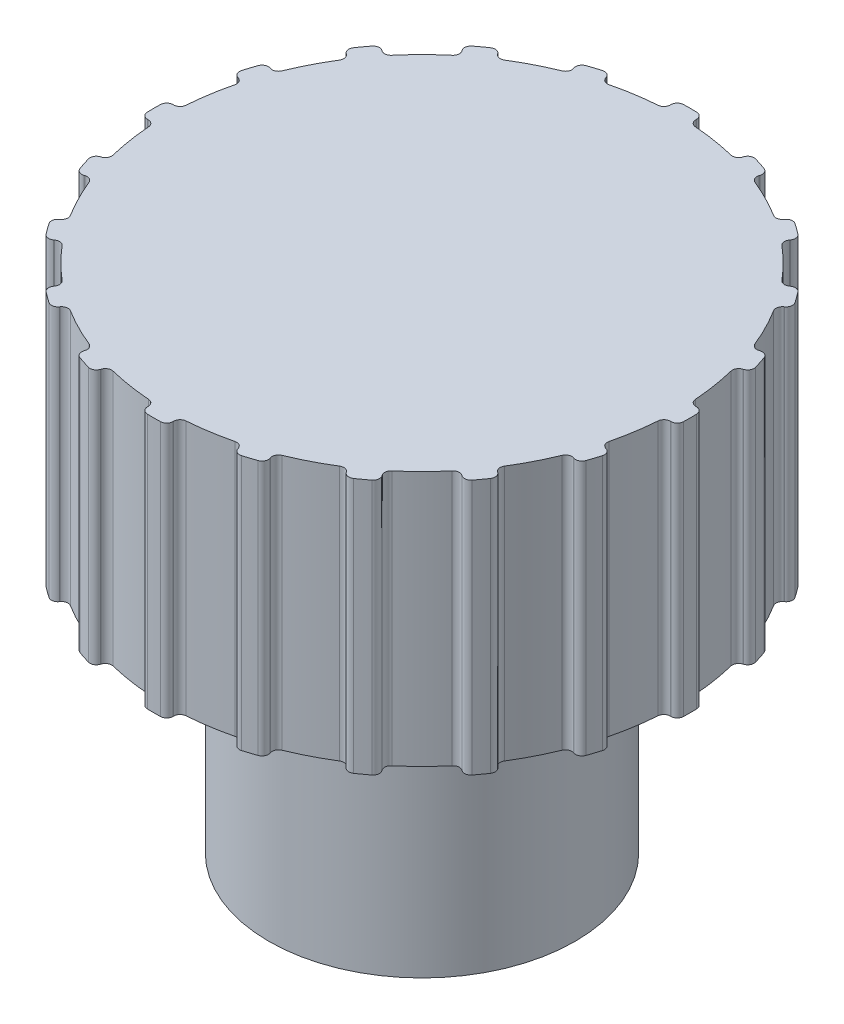
from build123d import *

# Parameters (mm, degrees)
SKETCH1_R                = 6
SKETCH1_R_2              = 4.1
BOSS_EXTRUDE1_DEPTH      = 10
SKETCH2_R                = 10
BOSS_EXTRUDE2_DEPTH      = 10
BOSS_EXTRUDE4_START      = -10
BOSS_EXTRUDE4_DEPTH      = 10
FILLET2_R                = 0.25
FILLET3_R                = 2
CIRPATTERN2_COUNT        = 20
FILLET2_OF_CIRPATTERN2_R = 0.25


with BuildPart() as part:
    # Sketch1 → Boss-Extrude1 (new body)
    with BuildSketch(Plane(origin=(0, 0, 0), x_dir=(1, 0, 0), z_dir=(0, 1, 0))):
        with Locations(Location((0, 0, 0), (0, 0, 270))):
            Circle(SKETCH1_R)
        with Locations(Location((0, 0, 0), (0, 0, 270))):
            Circle(SKETCH1_R_2, mode=Mode.SUBTRACT)
    extrude(amount=BOSS_EXTRUDE1_DEPTH)

    # Sketch2 → Boss-Extrude2 (add)
    with BuildSketch(Plane(origin=(0, 10, 0), x_dir=(1, 0, 0), z_dir=(0, 1, 0))):
        with Locations(Location((0, 0, 0), (0, 0, 270))):
            Circle(SKETCH2_R)
    extrude(amount=BOSS_EXTRUDE2_DEPTH)

    # Sketch4 → Boss-Extrude4 (add)
    with BuildSketch(Plane(origin=(0, 20, 0), x_dir=(1, 0, 0), z_dir=(0, 1, 0)).offset(BOSS_EXTRUDE4_START)):
        with BuildLine():
            Line((0.5, 10.488088482), (0.5, 9.987492178))
            ThreePointArc((0.5, 9.987492178), (0, 10), (-0.5, 9.987492178))
            Line((-0.5, 9.987492178), (-0.5, 10.488088482))
            ThreePointArc((-0.5, 10.488088482), (0, 10.5), (0.5, 10.488088482))
        make_face()
    boss_extrude4 = extrude(amount=BOSS_EXTRUDE4_DEPTH)

    # Fillet2
    fillet2_edges = [part.edges().sort_by_distance(p)[0] for p in [
        (-0.5, 15, -10.488088482),
        (0.5, 15, -10.488088482),
        (0.5, 15, -9.987492178),
        (-0.5, 15, -9.987492178),
    ]]
    fillet(fillet2_edges, radius=FILLET2_R)

    # Fillet3
    fillet3_edges = [part.edges().sort_by_distance(p)[0] for p in [
        (0, 10, -6),
    ]]
    fillet(fillet3_edges, radius=FILLET3_R)

    # CirPattern2: Boss-Extrude4 ×20 about axis
    cirpattern2_axis = Axis((0, 0, 0), (0, 1, 0))
    for i in range(1, CIRPATTERN2_COUNT):
        add(boss_extrude4.rotate(cirpattern2_axis, i * 360 / CIRPATTERN2_COUNT))

    # Fillet2 of CirPattern2
    fillet2_of_cirpattern2_edges = [part.edges().sort_by_distance(p)[0] for p in [
        (-3.716525838, 15, -9.820256397),
        (-2.765469321, 15, -10.129273391),
        (-2.610776556, 15, -9.653178014),
        (-3.561833072, 15, -9.34416102),
        (-6.569252231, 15, -8.191149194),
        (-5.760235237, 15, -8.778934446),
        (-5.465992112, 15, -8.373943529),
        (-6.275009107, 15, -7.786158277),
        (-8.778934446, 15, -5.760235237),
        (-8.191149194, 15, -6.569252231),
        (-7.786158277, 15, -6.275009107),
        (-8.373943529, 15, -5.465992112),
        (-10.129273391, 15, -2.765469321),
        (-9.820256397, 15, -3.716525838),
        (-9.34416102, 15, -3.561833072),
        (-9.653178014, 15, -2.610776556),
        (-10.488088482, 15, 0.5),
        (-10.488088482, 15, -0.5),
        (-9.987492178, 15, -0.5),
        (-9.987492178, 15, 0.5),
        (-9.820256397, 15, 3.716525838),
        (-10.129273391, 15, 2.765469321),
        (-9.653178014, 15, 2.610776556),
        (-9.34416102, 15, 3.561833072),
        (-8.191149194, 15, 6.569252231),
        (-8.778934446, 15, 5.760235237),
        (-8.373943529, 15, 5.465992112),
        (-7.786158277, 15, 6.275009107),
        (-5.760235237, 15, 8.778934446),
        (-6.569252231, 15, 8.191149194),
        (-6.275009107, 15, 7.786158277),
        (-5.465992112, 15, 8.373943529),
        (-2.765469321, 15, 10.129273391),
        (-3.716525838, 15, 9.820256397),
        (-3.561833072, 15, 9.34416102),
        (-2.610776556, 15, 9.653178014),
        (0.5, 15, 10.488088482),
        (-0.5, 15, 10.488088482),
        (-0.5, 15, 9.987492178),
        (0.5, 15, 9.987492178),
        (3.716525838, 15, 9.820256397),
        (2.765469321, 15, 10.129273391),
        (2.610776556, 15, 9.653178014),
        (3.561833072, 15, 9.34416102),
        (6.569252231, 15, 8.191149194),
        (5.760235237, 15, 8.778934446),
        (5.465992112, 15, 8.373943529),
        (6.275009107, 15, 7.786158277),
        (8.778934446, 15, 5.760235237),
        (8.191149194, 15, 6.569252231),
        (7.786158277, 15, 6.275009107),
        (8.373943529, 15, 5.465992112),
        (10.129273391, 15, 2.765469321),
        (9.820256397, 15, 3.716525838),
        (9.34416102, 15, 3.561833072),
        (9.653178014, 15, 2.610776556),
        (10.488088482, 15, -0.5),
        (10.488088482, 15, 0.5),
        (9.987492178, 15, 0.5),
        (9.987492178, 15, -0.5),
        (9.820256397, 15, -3.716525838),
        (10.129273391, 15, -2.765469321),
        (9.653178014, 15, -2.610776556),
        (9.34416102, 15, -3.561833072),
        (8.191149194, 15, -6.569252231),
        (8.778934446, 15, -5.760235237),
        (8.373943529, 15, -5.465992112),
        (7.786158277, 15, -6.275009107),
        (5.760235237, 15, -8.778934446),
        (6.569252231, 15, -8.191149194),
        (6.275009107, 15, -7.786158277),
        (5.465992112, 15, -8.373943529),
        (2.765469321, 15, -10.129273391),
        (3.716525838, 15, -9.820256397),
        (3.561833072, 15, -9.34416102),
        (2.610776556, 15, -9.653178014),
    ]]
    fillet(fillet2_of_cirpattern2_edges, radius=FILLET2_OF_CIRPATTERN2_R)


solid = part.part
